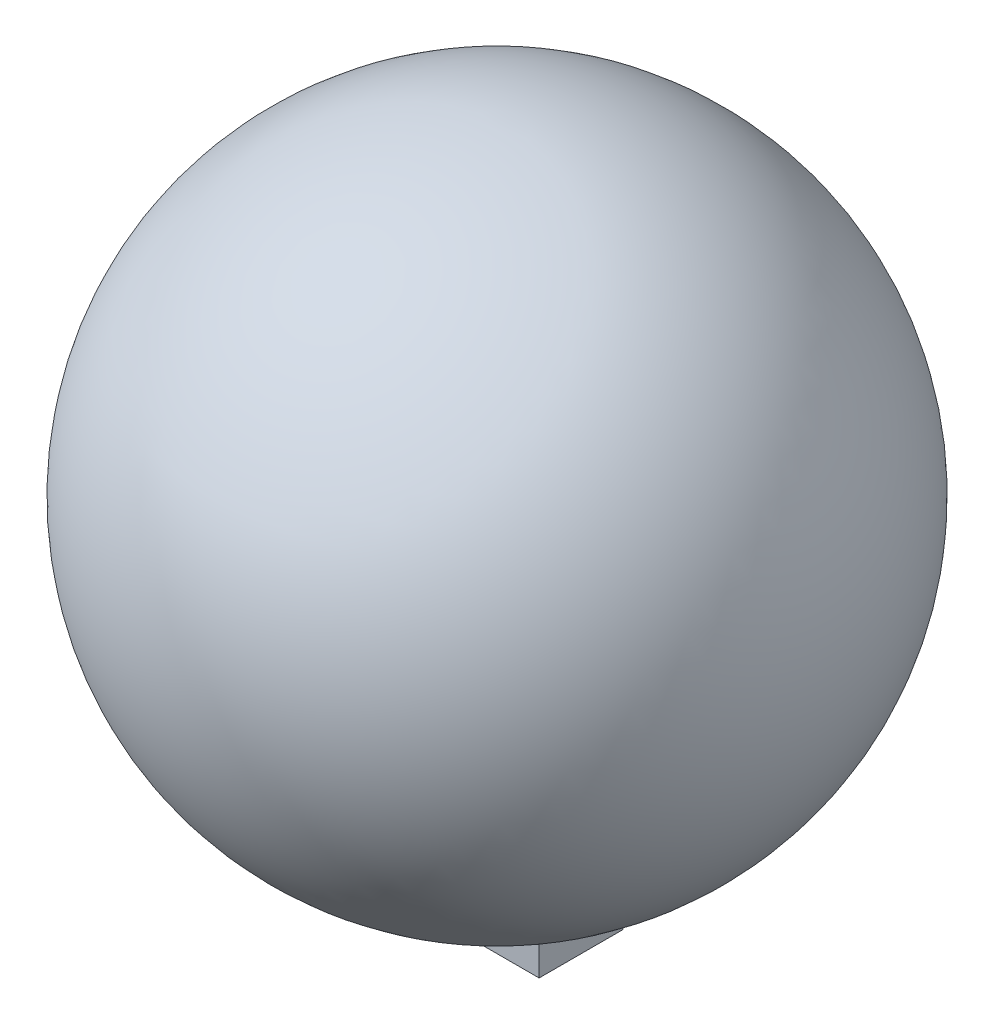
from build123d import *

# Parameters (mm, degrees)
ESQUISSE2_W             = 20
ESQUISSE2_H             = 10
BOSS_EXTRU_1_DEPTH      = 10
ENL_V_MAT_EXTRU_2_DEPTH = 10


with BuildPart() as part:
    # Esquisse1 → Révolution3 (revolve)
    with BuildSketch(Plane.XY):
        with BuildLine():
            Line((0, 0), (-20, 0))
            ThreePointArc((-20, 0), (-36.400549446, 42.543014128), (0, 70))
            Line((0, 70), (0, 67))
            ThreePointArc((0, 67), (-33.398032448, 42.122428112), (-19.123657749, 3))
            Line((-19.123657749, 3), (0, 3))
            Line((0, 3), (0, 0))
        make_face()
    revolve(axis=Axis((0, 0, 0), (0, 1, 0)))

    # Esquisse2 → Boss.-Extru.1 (add)
    with BuildSketch(Plane.XZ):
        Rectangle(ESQUISSE2_W, ESQUISSE2_H)
    extrude(amount=BOSS_EXTRU_1_DEPTH)

    # Esquisse3 → Enlèv. mat.-Extru.2 (cut)
    with BuildSketch(Plane(origin=(0, 0, -5), x_dir=(-1, 0, 0), z_dir=(0, 0, -1))):
        Polygon((7, -3), (7, 0), (-7, 0), (-7, -3), (-7, -7), (7, -7), align=None)
    extrude(amount=-ENL_V_MAT_EXTRU_2_DEPTH, mode=Mode.SUBTRACT)


solid = part.part
